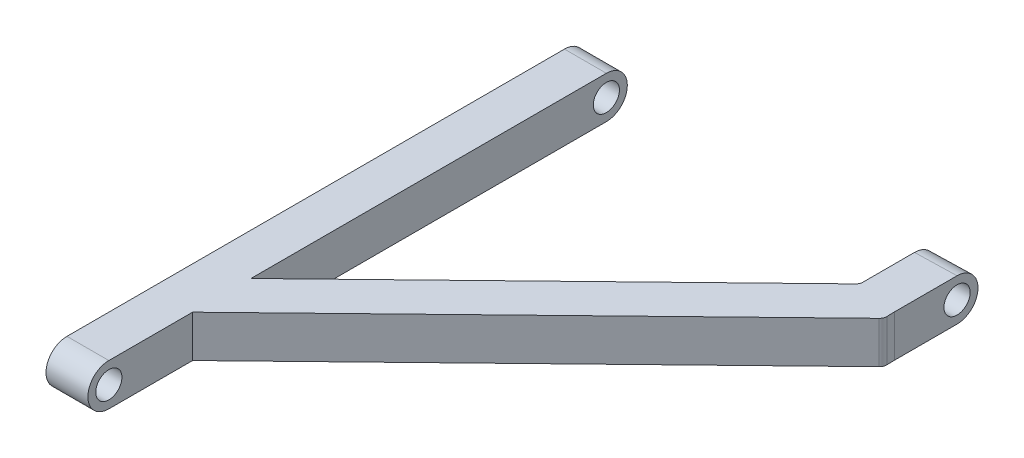
from build123d import *

# Parameters (mm, degrees)
CROQUIS1_R                 = 12.5
SALIENTE_EXTRUIR1_DEPTH    = 40
SALIENTE_EXTRUIR2_DEPTH    = 40
CORTAR_EXTRUIR2_DEPTH      = 45
CORTAR_EXTRUIR2_DEPTH_BACK = 45
CROQUIS3_R                 = 12.5


with BuildPart() as part:
    # Croquis1 → Saliente-Extruir1 (new body)
    with BuildSketch(Plane(origin=(0, 0, 0), x_dir=(0, 0, -1), z_dir=(1, 0, 0))):
        with BuildLine():
            ThreePointArc((0, 20), (-20, 0), (0, -20))
            Line((0, -20), (475, -20))
            ThreePointArc((475, -20), (495, 0), (475, 20))
            Line((475, 20), (0, 20))
        make_face()
        with Locations((475, 0)):
            Circle(CROQUIS1_R, mode=Mode.SUBTRACT)
        Circle(CROQUIS1_R, mode=Mode.SUBTRACT)
    extrude(amount=SALIENTE_EXTRUIR1_DEPTH)

    # Croquis2 → Saliente-Extruir2 (add)
    with BuildSketch(Plane(origin=(0, 20, 0), x_dir=(1, 0, 0), z_dir=(0, 1, 0))):
        with BuildLine():
            Line((40, 135.706571889), (40, 80))
            Line((40, 80), (372.872939005, 402.648821131))
            ThreePointArc((372.872939005, 402.648821131), (374.476832278, 405.021700465), (374.992889328, 407.83891808))
            Line((374.992889328, 407.83891808), (374.806076613, 415.181628683))
            Line((374.806076613, 415.181628683), (374.806076613, 495))
            Line((374.806076613, 495), (335.193923387, 495))
            Line((335.193923387, 495), (335.193923387, 462.022456719))
            Line((335.193923387, 462.022456719), (335.193923387, 424.789203994))
            ThreePointArc((335.193923387, 424.789203994), (334.64151447, 422.067558315), (333.071714854, 419.776654567))
            Line((333.071714854, 419.776654567), (40, 135.706571889))
        make_face()
    extrude(amount=-SALIENTE_EXTRUIR2_DEPTH)

    # Croquis3 → Cortar-Extruir2 (cut, two sides: drawn at the far end of the back side and taken through both)
    with BuildSketch(Plane(origin=(385.119812841, 0, -9.798190532), x_dir=(-0.025433697775531394, 0, -0.9996765111862251), z_dir=(0.9996765111862251, 0, -0.025433697775531394)).offset(-CORTAR_EXTRUIR2_DEPTH_BACK)):
        with Locations((465.30716856, 0)):
            Circle(CROQUIS3_R)
        with BuildLine():
            Line((465.30716856, 20), (485.30716856, 20))
            Line((485.30716856, 20), (531.151017537, 20))
            Line((531.151017537, 20), (531.151017537, -20))
            Line((531.151017537, -20), (485.30716856, -20))
            Line((485.30716856, -20), (465.30716856, -20))
            ThreePointArc((465.30716856, -20), (485.30716856, 0), (465.30716856, 20))
        make_face()
    extrude(amount=CORTAR_EXTRUIR2_DEPTH + CORTAR_EXTRUIR2_DEPTH_BACK, mode=Mode.SUBTRACT)


solid = part.part
